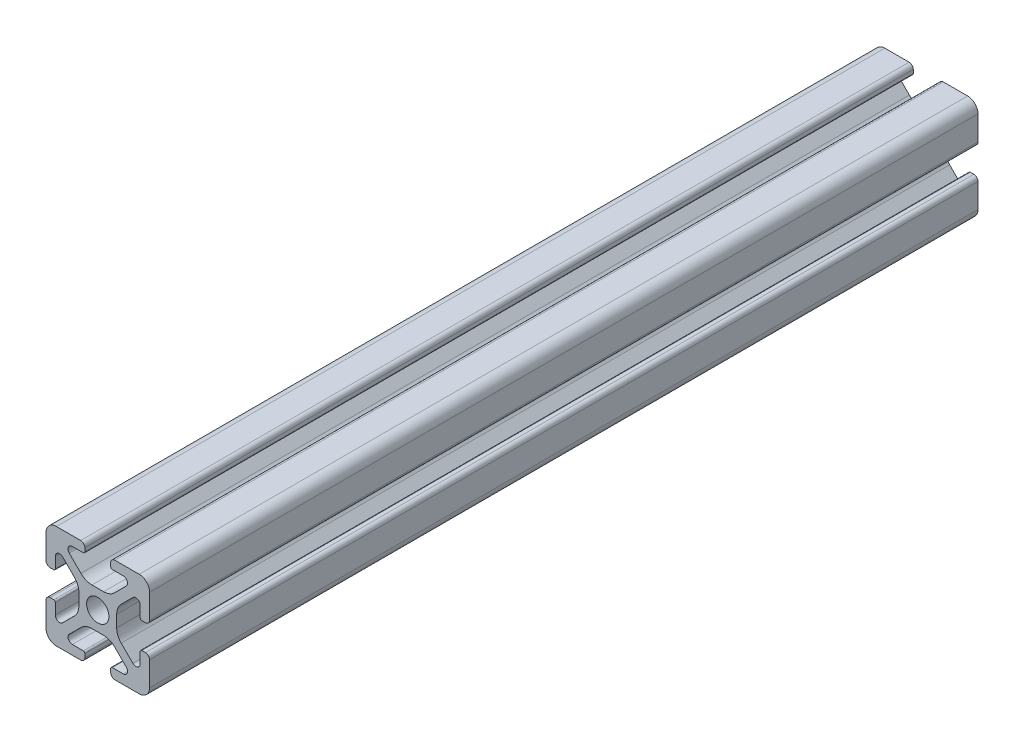
from build123d import *

# Parameters (mm, degrees)
BOSS_EXTRU_1_DEPTH = 160


with BuildPart() as part:
    # Esquisse1 → Boss.-Extru.1 (new body)
    with BuildSketch(Plane.XY):
        with BuildLine():
            Line((-3.255887446, 4.528679645), (-5.506192286, 6.778984485))
            ThreePointArc((-5.506192286, 6.778984485), (-5.686636441, 7.686138511), (-4.917588391, 8.199999989))
            Line((-4.917588391, 8.199999989), (-2.799999991, 8.199999989))
            ThreePointArc((-2.799999991, 8.199999989), (-2.587867957, 8.287867955), (-2.499999991, 8.499999989))
            Line((-2.499999991, 8.499999989), (-2.499999991, 9.199999989))
            ThreePointArc((-2.499999991, 9.199999989), (-2.734314566, 9.765685414), (-3.299999991, 9.999999989))
            Line((-3.299999991, 9.999999989), (-7.999999991, 9.999999989))
            ThreePointArc((-7.999999991, 9.999999989), (-9.414213554, 9.414213552), (-9.999999991, 7.999999989))
            Line((-9.999999991, 7.999999989), (-9.999999991, 3.299999989))
            ThreePointArc((-9.999999991, 3.299999989), (-9.765685416, 2.734314564), (-9.199999991, 2.499999989))
            Line((-9.199999991, 2.499999989), (-8.499999991, 2.499999989))
            ThreePointArc((-8.499999991, 2.499999989), (-8.287867957, 2.587867955), (-8.199999991, 2.799999989))
            Line((-8.199999991, 2.799999989), (-8.199999991, 4.917588389))
            ThreePointArc((-8.199999991, 4.917588389), (-7.686138517, 5.686636433), (-6.778984497, 5.506192279))
            Line((-6.778984497, 5.506192279), (-4.528679657, 3.255887439))
            ThreePointArc((-4.528679657, 3.255887439), (-3.878361403, 2.282617393), (-3.650000001, 1.134567096))
            Line((-3.650000001, 1.134567096), (-3.650000001, -1.134567114))
            ThreePointArc((-3.650000001, -1.134567114), (-3.878361403, -2.282617409), (-4.528679656, -3.255887454))
            Line((-4.528679656, -3.255887454), (-6.778984496, -5.506192294))
            ThreePointArc((-6.778984496, -5.506192294), (-7.686138522, -5.686636449), (-8.2, -4.9175884))
            Line((-8.2, -4.9175884), (-8.2, -2.8))
            ThreePointArc((-8.2, -2.8), (-8.287867966, -2.587867966), (-8.5, -2.5))
            Line((-8.5, -2.5), (-9.2, -2.5))
            ThreePointArc((-9.2, -2.5), (-9.765685425, -2.734314575), (-10, -3.3))
            Line((-10, -3.3), (-10, -8))
            ThreePointArc((-10, -8), (-9.414213562, -9.414213562), (-8, -10))
            Line((-8, -10), (-3.3, -10))
            ThreePointArc((-3.3, -10), (-2.734314575, -9.765685425), (-2.5, -9.2))
            Line((-2.5, -9.2), (-2.5, -8.5))
            ThreePointArc((-2.5, -8.5), (-2.587867966, -8.287867966), (-2.8, -8.2))
            Line((-2.8, -8.2), (-4.9175884, -8.2))
            ThreePointArc((-4.9175884, -8.2), (-5.686636444, -7.686138526), (-5.50619229, -6.778984506))
            Line((-5.50619229, -6.778984506), (-3.25588745, -4.528679666))
            ThreePointArc((-3.25588745, -4.528679666), (-2.282617404, -3.878361412), (-1.134567106, -3.650000009))
            Line((-1.134567106, -3.650000009), (1.134567104, -3.650000009))
            ThreePointArc((1.134567104, -3.650000009), (2.282617399, -3.878361412), (3.255887444, -4.528679664))
            Line((3.255887444, -4.528679664), (5.506192284, -6.778984504))
            ThreePointArc((5.506192284, -6.778984504), (5.686636439, -7.686138531), (4.917588389, -8.200000009))
            Line((4.917588389, -8.200000009), (2.799999989, -8.200000009))
            ThreePointArc((2.799999989, -8.200000009), (2.587867955, -8.287867974), (2.499999989, -8.500000009))
            Line((2.499999989, -8.500000009), (2.499999989, -9.200000009))
            ThreePointArc((2.499999989, -9.200000009), (2.734314564, -9.765685434), (3.299999989, -10.000000009))
            Line((3.299999989, -10.000000009), (7.999999989, -10.000000009))
            ThreePointArc((7.999999989, -10.000000009), (9.414213552, -9.414213571), (9.999999989, -8.000000009))
            Line((9.999999989, -8.000000009), (9.999999989, -3.300000009))
            ThreePointArc((9.999999989, -3.300000009), (9.765685414, -2.734314584), (9.199999989, -2.500000009))
            Line((9.199999989, -2.500000009), (8.499999989, -2.500000009))
            ThreePointArc((8.499999989, -2.500000009), (8.287867955, -2.587867974), (8.199999989, -2.800000009))
            Line((8.199999989, -2.800000009), (8.199999989, -4.917588409))
            ThreePointArc((8.199999989, -4.917588409), (7.686138515, -5.686636452), (6.778984495, -5.506192299))
            Line((6.778984495, -5.506192299), (4.528679655, -3.255887459))
            ThreePointArc((4.528679655, -3.255887459), (3.878361401, -2.282617412), (3.649999999, -1.134567115))
            Line((3.649999999, -1.134567115), (3.649999999, 1.134567095))
            ThreePointArc((3.649999999, 1.134567095), (3.878361401, 2.28261739), (4.528679654, 3.255887435))
            Line((4.528679654, 3.255887435), (6.778984494, 5.506192275))
            ThreePointArc((6.778984494, 5.506192275), (7.68613852, 5.68663643), (8.199999998, 4.917588381))
            Line((8.199999998, 4.917588381), (8.199999998, 2.799999981))
            ThreePointArc((8.199999998, 2.799999981), (8.287867964, 2.587867946), (8.499999998, 2.499999981))
            Line((8.499999998, 2.499999981), (9.199999998, 2.499999981))
            ThreePointArc((9.199999998, 2.499999981), (9.765685423, 2.734314556), (9.999999998, 3.299999981))
            Line((9.999999998, 3.299999981), (9.999999998, 7.999999981))
            ThreePointArc((9.999999998, 7.999999981), (9.41421356, 9.414213543), (7.999999998, 9.999999981))
            Line((7.999999998, 9.999999981), (3.299999998, 9.999999981))
            ThreePointArc((3.299999998, 9.999999981), (2.734314573, 9.765685406), (2.499999998, 9.199999981))
            Line((2.499999998, 9.199999981), (2.499999998, 8.499999981))
            ThreePointArc((2.499999998, 8.499999981), (2.587867964, 8.287867946), (2.799999998, 8.199999981))
            Line((2.799999998, 8.199999981), (4.917588398, 8.199999981))
            ThreePointArc((4.917588398, 8.199999981), (5.686636442, 7.686138507), (5.506192288, 6.778984487))
            Line((5.506192288, 6.778984487), (3.255887448, 4.528679647))
            ThreePointArc((3.255887448, 4.528679647), (2.282617402, 3.878361393), (1.134567104, 3.64999999))
            Line((1.134567104, 3.64999999), (-1.134567106, 3.64999999))
            ThreePointArc((-1.134567106, 3.64999999), (-2.282617401, 3.878361392), (-3.255887446, 4.528679645))
        make_face()
        with BuildLine():
            ThreePointArc((-2.15, 0), (0, -2.15), (2.15, 0))
            ThreePointArc((2.15, 0), (0, 2.15), (-2.15, 0))
        make_face(mode=Mode.SUBTRACT)
    extrude(amount=BOSS_EXTRU_1_DEPTH)


solid = part.part
